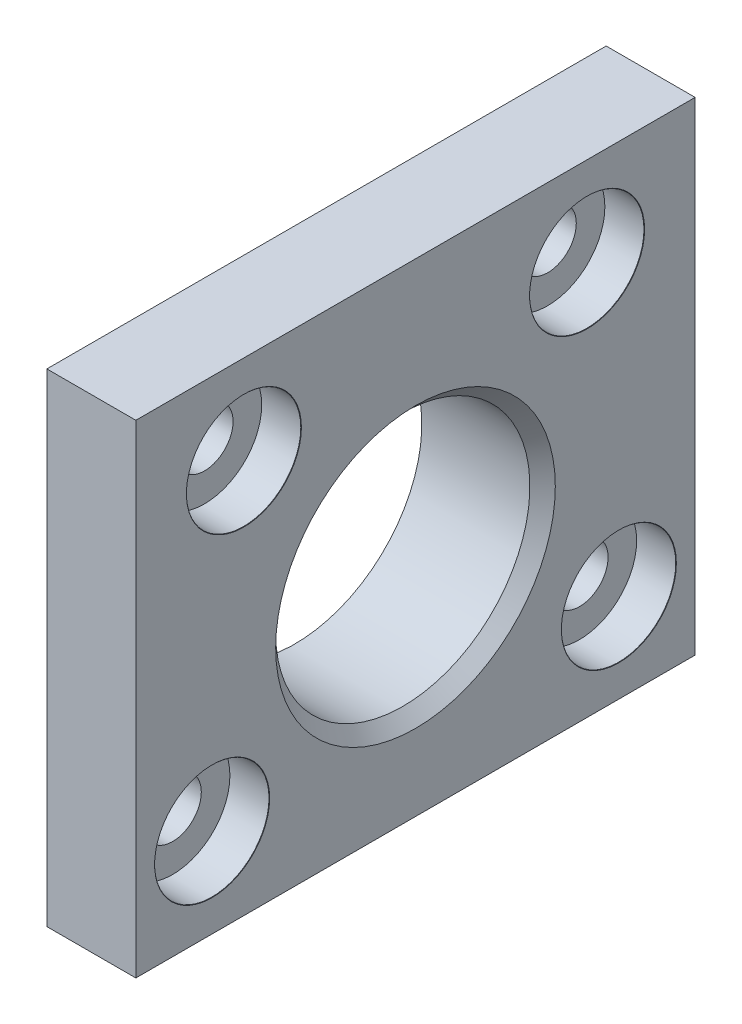
from build123d import *

# Parameters (mm, degrees)
ESBO_O1_W                                    = 44
ESBO_O1_H                                    = 38
ESBO_O1_R                                    = 10
RESSALTO_EXTRUS_O1_DEPTH                     = 7
ESBO_O2_R                                    = 15.4
ESBO_O2_R_2                                  = 10
RESSALTO_EXTRUS_O2_DEPTH                     = 2.5
CHANFRO1_SIZE                                = 1
REBAIXO_PARA_PARAFUSO_COM_CABE_A_PAN_2_COUNT = 2
REBAIXO_PARA_PARAFUSO_COM_CABE_A_PAN_2_PITCH = 27
REBAIXO_PARA_PARAFUSO_COM_CABE_A_PAN_3_COUNT = 2
REBAIXO_PARA_PARAFUSO_COM_CABE_A_PAN_3_PITCH = 38.02959374
REBAIXO_PARA_PARAFUSO_COM_CABE_A_PAN_4_COUNT = 2
REBAIXO_PARA_PARAFUSO_COM_CABE_A_PAN_4_PITCH = 24.129857024


with BuildPart() as part:
    # Esboço1 → Ressalto-extrusão1 (new body)
    with BuildSketch(Plane(origin=(0, 0, 0), x_dir=(0, 0, -1), z_dir=(1, 0, 0))):
        with Locations((22, 19)):
            Rectangle(ESBO_O1_W, ESBO_O1_H)
        with Locations((22, 17)):
            Circle(ESBO_O1_R, mode=Mode.SUBTRACT)
    extrude(amount=-RESSALTO_EXTRUS_O1_DEPTH)

    # Esboço2 → Ressalto-extrusão2 (add)
    with BuildSketch(Plane.ZY.offset(7)):
        with Locations((-22, 17)):
            Circle(ESBO_O2_R)
        with Locations(Location((-22, 17, 0), (0, 0, 180))):
            Circle(ESBO_O2_R_2, mode=Mode.SUBTRACT)
    extrude(amount=RESSALTO_EXTRUS_O2_DEPTH)

    # Chanfro1
    chanfro1_edges = [part.edges().sort_by_distance(p)[0] for p in [
        (0, 17, -12),
    ]]
    chamfer(chanfro1_edges, length=CHANFRO1_SIZE)

    # Esboço4 → Rebaixo para parafuso com cabeça panela de M41 (revolve, cut)
    with BuildSketch(Plane(origin=(0, 31, -8.5), x_dir=(0, 0, -1), z_dir=(0, 1, 0))):
        Polygon((0, 0), (0, 9.5), (2.25, 9.5), (2.25, 3.1), (4.5, 3.1), (4.5, 0.025), (4.525, 0), align=None)
    rebaixo_para_parafuso_com_cabe_a_panela = revolve(axis=Axis((6.35, 31, -8.5), (-1, 0, 0)), mode=Mode.SUBTRACT)

    # Rebaixo para parafuso com cabe_a pan 2: Rebaixo para parafuso com cabeça panela de M41 ×2
    with Locations(*[(0, 0, -i * REBAIXO_PARA_PARAFUSO_COM_CABE_A_PAN_2_PITCH) for i in range(1, REBAIXO_PARA_PARAFUSO_COM_CABE_A_PAN_2_COUNT)]):
        add(rebaixo_para_parafuso_com_cabe_a_panela, mode=Mode.SUBTRACT)

    # Rebaixo para parafuso com cabe_a pan 3: Rebaixo para parafuso com cabeça panela de M41 ×2
    with Locations(*[Vector(0, -0.6310874674162201, -0.7757116786991037) * (i * REBAIXO_PARA_PARAFUSO_COM_CABE_A_PAN_3_PITCH) for i in range(1, REBAIXO_PARA_PARAFUSO_COM_CABE_A_PAN_3_COUNT)]):
        add(rebaixo_para_parafuso_com_cabe_a_panela, mode=Mode.SUBTRACT)

    # Rebaixo para parafuso com cabe_a pan 4: Rebaixo para parafuso com cabeça panela de M41 ×2
    with Locations(*[Vector(0, -0.9946184088907778, 0.10360608425945594) * (i * REBAIXO_PARA_PARAFUSO_COM_CABE_A_PAN_4_PITCH) for i in range(1, REBAIXO_PARA_PARAFUSO_COM_CABE_A_PAN_4_COUNT)]):
        add(rebaixo_para_parafuso_com_cabe_a_panela, mode=Mode.SUBTRACT)


solid = part.part
